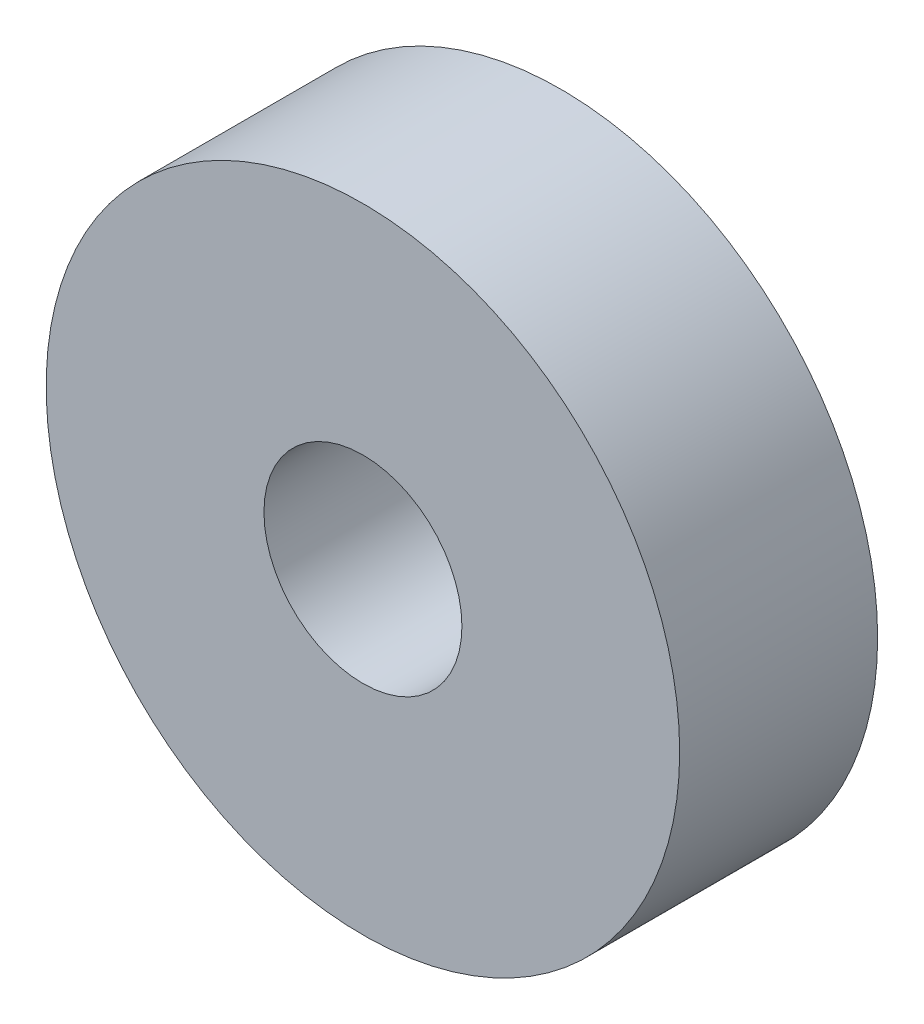
from build123d import *

# Parameters (mm, degrees)
SKETCH1_R           = 8
BOSS_EXTRUDE1_DEPTH = 2.5
SKETCH2_R           = 2.5
CUT_EXTRUDE1_DEPTH  = 13.369316877


with BuildPart() as part:
    # Sketch1 → Boss-Extrude1 (new, symmetric)
    with BuildSketch(Plane.XY):
        Circle(SKETCH1_R)
    extrude(amount=BOSS_EXTRUDE1_DEPTH, both=True)

    # Sketch2 → Cut-Extrude1 (cut, through all)
    with BuildSketch(Plane.XY.offset(2.5)):
        Circle(SKETCH2_R)
    extrude(amount=-CUT_EXTRUDE1_DEPTH, mode=Mode.SUBTRACT)


solid = part.part
